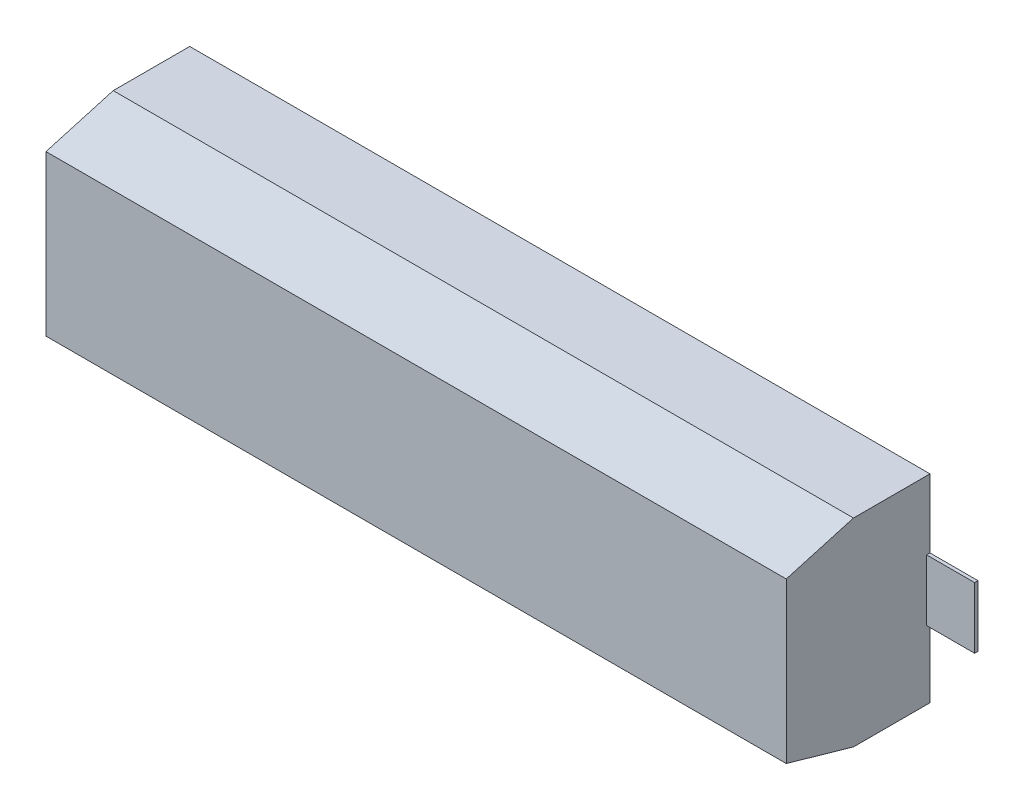
from build123d import *
from OCP.BRepFilletAPI import BRepFilletAPI_MakeChamfer

# Parameters (mm, degrees)
SKETCH1_W           = 77.11
SKETCH1_H           = 20.65
BOSS_EXTRUDE1_DEPTH = 14.97
CHAMFER1_SIZE       = 7
CHAMFER1_SIZE2      = 2
SKETCH2_W           = 5
SKETCH2_H           = 6.38
BOSS_EXTRUDE2_DEPTH = 0.35


with BuildPart() as part:
    # Sketch1 → Boss-Extrude1 (new body)
    with BuildSketch(Plane.XY):
        Rectangle(SKETCH1_W, SKETCH1_H)
    extrude(amount=BOSS_EXTRUDE1_DEPTH)

    # Chamfer1: one chamfer whose edges measure the first distance from different faces: ONE call of the kernel's chamfer builder (chamfer() names one face for all edges)
    chamfer1_edges_1 = [part.edges().sort_by_distance(p)[0] for p in [
        (0, -10.325, 14.97),
    ]]
    chamfer1_side_1 = [part.faces().sort_by_distance(p)[0] for p in [
        (0, -10.325, 7.485),
    ]]
    chamfer1_edges_2 = [part.edges().sort_by_distance(p)[0] for p in [
        (0, 10.325, 14.97),
    ]]
    chamfer1_side_2 = [part.faces().sort_by_distance(p)[0] for p in [
        (0, 10.325, 7.485),
    ]]
    chamfer1 = BRepFilletAPI_MakeChamfer(part.part.solid().wrapped)
    for e in chamfer1_edges_1:
        chamfer1.Add(CHAMFER1_SIZE, CHAMFER1_SIZE2, e.wrapped, chamfer1_side_1[0].wrapped)  # the first distance lies on this face
    for e in chamfer1_edges_2:
        chamfer1.Add(CHAMFER1_SIZE, CHAMFER1_SIZE2, e.wrapped, chamfer1_side_2[0].wrapped)  # the first distance lies on this face
    add(Compound.cast(chamfer1.Shape()), mode=Mode.REPLACE)

    # Sketch2 → Boss-Extrude2 (add)
    with BuildSketch(Plane(origin=(0, 0, 0), x_dir=(-1, 0, 0), z_dir=(0, 0, -1))):
        with Locations((-41.055, 0)):
            Rectangle(SKETCH2_W, SKETCH2_H)
        with Locations((41.055, 0)):
            Rectangle(SKETCH2_W, SKETCH2_H)
    extrude(amount=-BOSS_EXTRUDE2_DEPTH)


solid = part.part
